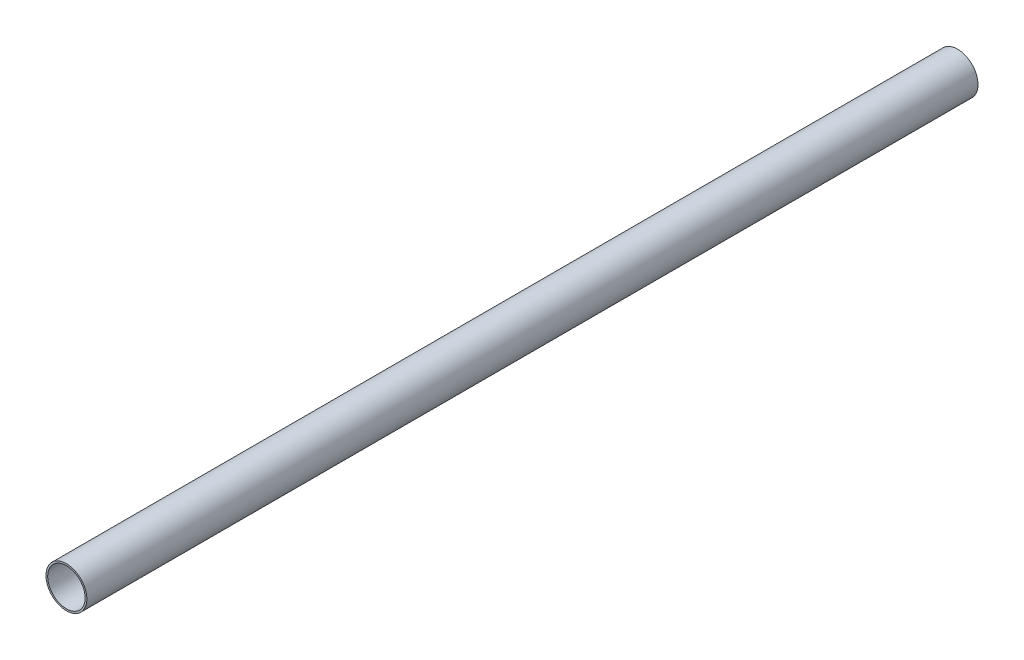
from build123d import *

# Parameters (mm, degrees)
SKETCH1_R           = 12.7
SKETCH1_R_2         = 11.6205
BOSS_EXTRUDE1_DEPTH = 553.63


with BuildPart() as part:
    # Sketch1 → Boss-Extrude1 (new body)
    with BuildSketch(Plane.XY):
        Circle(SKETCH1_R)
        Circle(SKETCH1_R_2, mode=Mode.SUBTRACT)
    extrude(amount=BOSS_EXTRUDE1_DEPTH)


solid = part.part
